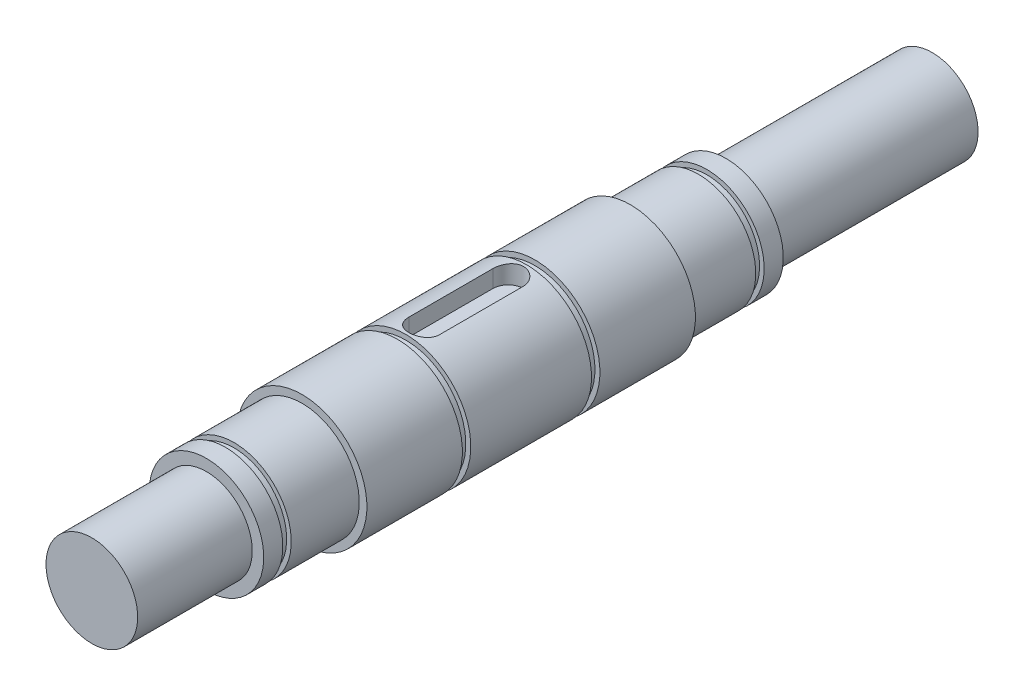
from build123d import *

# Parameters (mm, degrees)
SKETCH1_R               = 8.5
BOSS_EXTRUDE1_DEPTH     = 61
SKETCH2_W               = 39.5
SKETCH2_H               = 1
SKETCH3_W               = 27
SKETCH3_H               = 1.5
SKETCH4_W               = 1.1
SKETCH4_H               = 0.6
SKETCH5_W               = 1.1
SKETCH5_H               = 0.65
CUT_EXTRUDE1_DEPTH      = 63.173145328
CUT_EXTRUDE1_DEPTH_BACK = 63.173145328
SKETCH6_W               = 12
SKETCH6_H               = 12
CUT_EXTRUDE2_DEPTH      = 2.5


with BuildPart() as part:
    # Sketch1 → Boss-Extrude1 (new, symmetric)
    with BuildSketch(Plane.XY):
        with Locations(Location((0, 0, 0), (0, 0, 180))):
            Circle(SKETCH1_R)
    extrude(amount=BOSS_EXTRUDE1_DEPTH, both=True)

    # Sketch2 → Cut-Revolve1 (revolve, cut)
    with BuildSketch(Plane(origin=(0, 0, 0), x_dir=(0, 0, -1), z_dir=(1, 0, 0)), mode=Mode.PRIVATE) as cut_revolve1_sk:
        with Locations((41.25, 8)):
            Rectangle(SKETCH2_W, SKETCH2_H)
    cut_revolve1 = revolve(cut_revolve1_sk.sketch.rotate(Axis((0, 0, -67.1), (0, 0, 1)), 90), axis=Axis((0, 0, -67.1), (0, 0, 1)), mode=Mode.SUBTRACT)

    # Mirror1: Cut-Revolve1 across plane
    add(cut_revolve1.mirror(Plane.XY), mode=Mode.SUBTRACT)

    # Sketch3 → Cut-Revolve2 (revolve, cut)
    with BuildSketch(Plane(origin=(0, 0, 0), x_dir=(0, 0, -1), z_dir=(1, 0, 0)), mode=Mode.PRIVATE) as cut_revolve2_sk:
        with Locations((47.5, 6.75)):
            Rectangle(SKETCH3_W, SKETCH3_H)
    cut_revolve2 = revolve(cut_revolve2_sk.sketch.rotate(Axis((0, 0, -67.1), (0, 0, 1)), 90), axis=Axis((0, 0, -67.1), (0, 0, 1)), mode=Mode.SUBTRACT)

    # Mirror2: Cut-Revolve2 across plane
    add(cut_revolve2.mirror(Plane.XY), mode=Mode.SUBTRACT)

    # Sketch4 → Cut-Revolve3 (revolve, cut)
    with BuildSketch(Plane(origin=(0, 0, 0), x_dir=(0, 0, -1), z_dir=(1, 0, 0)), mode=Mode.PRIVATE) as cut_revolve3_sk:
        with Locations((30.95, 7.2)):
            Rectangle(SKETCH4_W, SKETCH4_H)
    cut_revolve3 = revolve(cut_revolve3_sk.sketch.rotate(Axis((0, 0, -67.1), (0, 0, 1)), 90), axis=Axis((0, 0, -67.1), (0, 0, 1)), mode=Mode.SUBTRACT)

    # Mirror3: Cut-Revolve3 across plane
    add(cut_revolve3.mirror(Plane.XY), mode=Mode.SUBTRACT)

    # Sketch5 → Cut-Revolve4 (revolve, cut)
    with BuildSketch(Plane(origin=(0, 0, 0), x_dir=(0, 0, -1), z_dir=(1, 0, 0)), mode=Mode.PRIVATE) as cut_revolve4_sk:
        with Locations((8.45, 8.175)):
            Rectangle(SKETCH5_W, SKETCH5_H)
    cut_revolve4 = revolve(cut_revolve4_sk.sketch.rotate(Axis((0, 0, -67.1), (0, 0, 1)), 90), axis=Axis((0, 0, -67.1), (0, 0, 1)), mode=Mode.SUBTRACT)

    # Mirror4: Cut-Revolve4 across plane
    add(cut_revolve4.mirror(Plane.XY), mode=Mode.SUBTRACT)

    # Sketch6 → Cut-Extrude1 (cut, two sides: drawn at the far end of the back side and taken through both)
    with BuildSketch(Plane(origin=(0, 0, 0), x_dir=(0, 0, -1), z_dir=(1, 0, 0)).offset(-CUT_EXTRUDE1_DEPTH_BACK)):
        with Locations((-55, 0)):
            Rectangle(SKETCH6_W, SKETCH6_H)
    extrude(amount=CUT_EXTRUDE1_DEPTH + CUT_EXTRUDE1_DEPTH_BACK, mode=Mode.SUBTRACT)

    # Sketch8 → Cut-Extrude2 (cut)
    with BuildSketch(Plane(origin=(0, 8.5, 0), x_dir=(1, 0, 0), z_dir=(0, 1, 0))):
        with BuildLine():
            Line((-2, -5.5), (-2, 5.5))
            ThreePointArc((-2, 5.5), (0, 7.5), (2, 5.5))
            Line((2, 5.5), (2, -5.5))
            ThreePointArc((2, -5.5), (0, -7.5), (-2, -5.5))
        make_face()
    extrude(amount=-CUT_EXTRUDE2_DEPTH, mode=Mode.SUBTRACT)


solid = part.part
